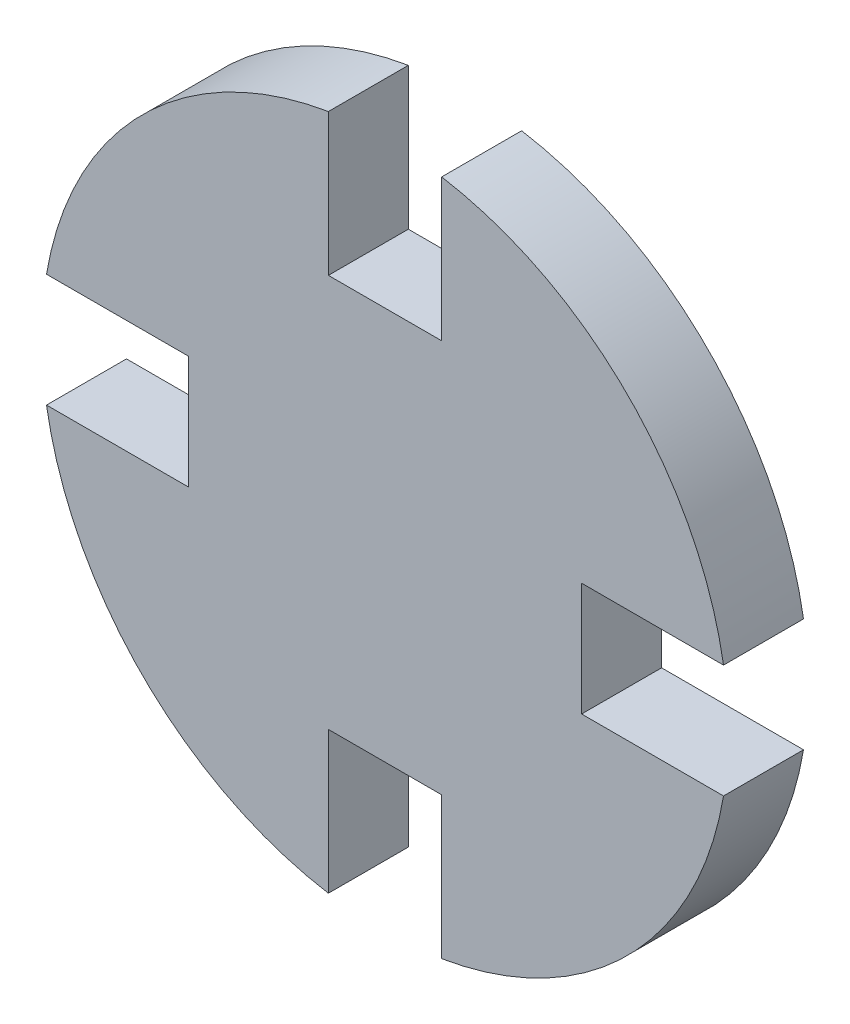
from build123d import *

# Parameters (mm, degrees)
BOSS_EXTRUDE1_DEPTH = 3
SKETCH3_R           = 5.1
CUT_EXTRUDE1_DEPTH  = 2.5


with BuildPart() as part:
    # Sketch2 → Boss-Extrude1 (new, symmetric)
    with BuildSketch(Plane.XY):
        with BuildLine():
            Line((-25.396850198, 4.25), (-14.75, 4.25))
            Line((-14.75, 4.25), (-14.75, -4.25))
            Line((-14.75, -4.25), (-25.396850198, -4.25))
            ThreePointArc((-25.396850198, -4.25), (-18.207999616, -18.207999616), (-4.25, -25.396850198))
            Line((-4.25, -25.396850198), (-4.25, -14.75))
            Line((-4.25, -14.75), (4.25, -14.75))
            Line((4.25, -14.75), (4.25, -25.396850198))
            ThreePointArc((4.25, -25.396850198), (18.207999616, -18.207999616), (25.396850198, -4.25))
            Line((25.396850198, -4.25), (14.75, -4.25))
            Line((14.75, -4.25), (14.75, 4.25))
            Line((14.75, 4.25), (25.396850198, 4.25))
            ThreePointArc((25.396850198, 4.25), (18.207999616, 18.207999616), (4.25, 25.396850198))
            Line((4.25, 25.396850198), (4.25, 14.75))
            Line((4.25, 14.75), (-4.25, 14.75))
            Line((-4.25, 14.75), (-4.25, 25.396850198))
            ThreePointArc((-4.25, 25.396850198), (-18.207999616, 18.207999616), (-25.396850198, 4.25))
        make_face()
    extrude(amount=BOSS_EXTRUDE1_DEPTH, both=True)

    # Sketch3 → Cut-Extrude1 (cut)
    with BuildSketch(Plane(origin=(0, 0, -3), x_dir=(-1, 0, 0), z_dir=(0, 0, -1))):
        Circle(SKETCH3_R)
    extrude(amount=-CUT_EXTRUDE1_DEPTH, mode=Mode.SUBTRACT)


solid = part.part
